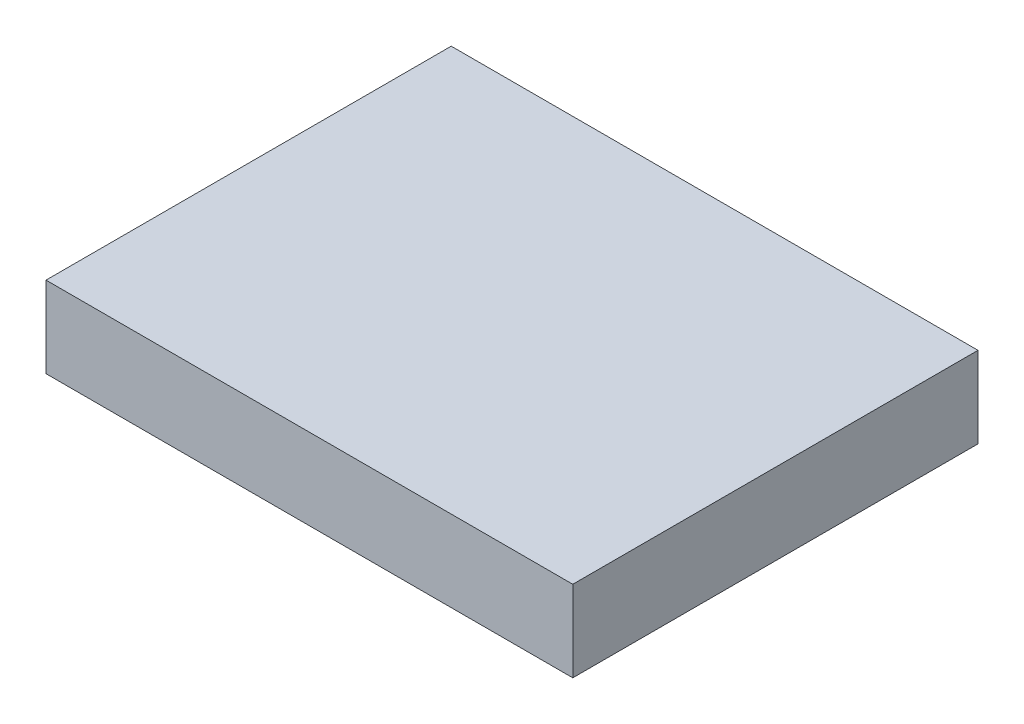
from build123d import *

# Parameters (mm, degrees)
BOSS_EXTRUDE1_DEPTH = 50.8


with BuildPart() as part:
    # Sketch1 → Boss-Extrude1 (new body)
    with BuildSketch(Plane(origin=(0, 0, 0), x_dir=(1, 0, 0), z_dir=(0, 1, 0))):
        Polygon((0, 203.2), (0, 0), (165.1, 0), (165.1, 254), (0, 254), align=None)
        Polygon((165.1, 254), (165.1, 0), (330.2, 0), (330.2, 203.2), (330.2, 254), align=None)
    extrude(amount=BOSS_EXTRUDE1_DEPTH)


solid = part.part
